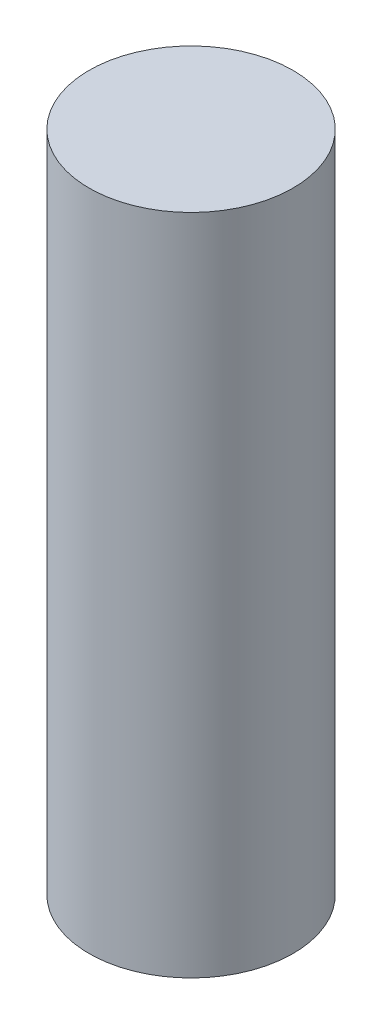
from build123d import *

# Parameters (mm, degrees)
SKETCH1_R           = 1
BOSS_EXTRUDE1_DEPTH = 6.5


with BuildPart() as part:
    # Sketch1 → Boss-Extrude1 (new body)
    with BuildSketch(Plane(origin=(0, 0, 0), x_dir=(1, 0, 0), z_dir=(0, 1, 0))):
        with Locations(Location((0, 0, 0), (0, 0, 90))):
            Circle(SKETCH1_R)
    extrude(amount=BOSS_EXTRUDE1_DEPTH)


solid = part.part
